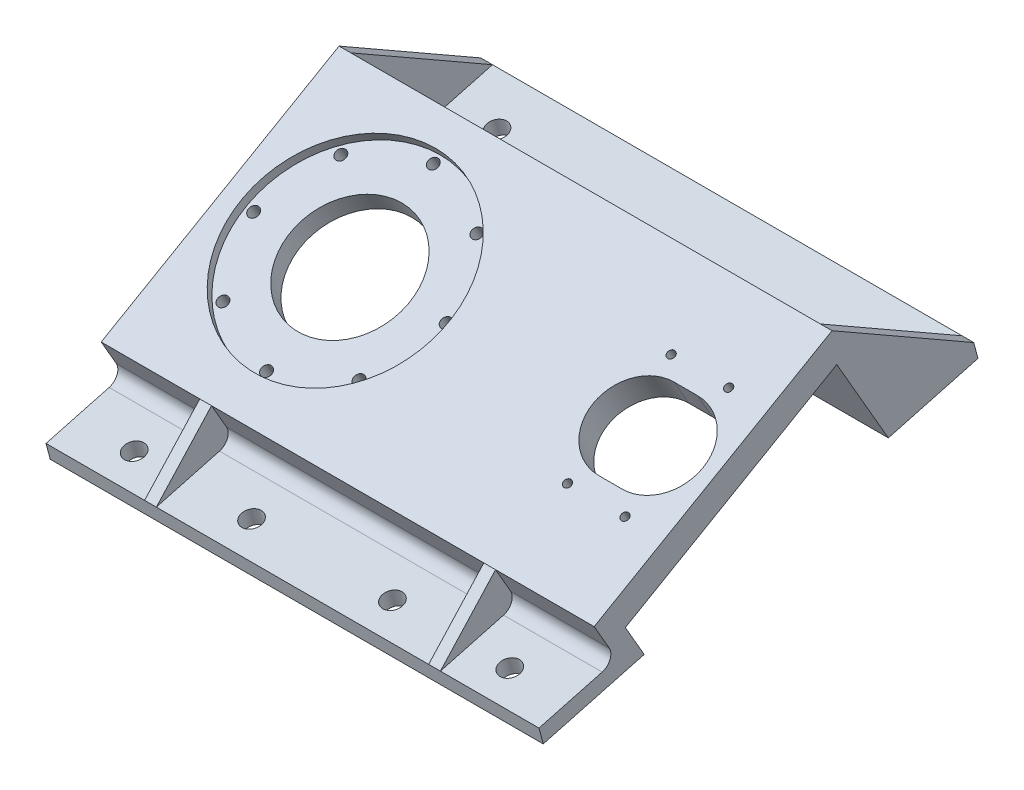
from build123d import *

# Parameters (mm, degrees)
EXTRUDE_1_DEPTH      = 30
SKETCH_2_R           = 44.45
CUT_EXTRUDE_1_DEPTH  = 4
SKETCH_3_R           = 25.5
SKETCH_3_R_2         = 2.25
CUT_EXTRUDE_2_DEPTH  = 188.619295383
CUT_EXTRUDE_3_DEPTH  = 189.215302247
SKETCH_5_R           = 1.65
CUT_EXTRUDE_4_DEPTH  = 189.215302247
EXTRUDE_START        = -30
EXTRUDE_2_DEPTH      = 30
CUT_EXTRUDE_5_DEPTH  = 198.040604952
CUT_EXTRUDE_7_DEPTH  = 233.432785983
CUT_EXTRUDE_8_DEPTH  = 233.432785983
CUT_EXTRUDE_9_DEPTH  = 233.432785983
FILLET_1_R           = 5
CUT_EXTRUDE_10_DEPTH = 233.432785983
EXTRUDE_START_2      = -5
EXTRUDE_3_DEPTH      = 5
EXTRUDE_4_DEPTH      = 5
SKETCH_14_R          = 4.25
CUT_EXTRUDE_11_DEPTH = 189.364728478
SKETCH_16_W          = 43
SKETCH_16_H          = 30
CUT_EXTRUDE_12_DEPTH = 233.432785983
EXTRUDE_7_REACH      = 188.592
SKETCH_18_W          = 210
SKETCH_18_H          = 5
EXTRUDE_8_DEPTH      = 210
EXTRUDE_9_DEPTH      = 5
EXTRUDE_10_DEPTH     = 5
SKETCH_22_R          = 4.25
CUT_EXTRUDE_13_DEPTH = 187.984035343
FILLET_2_R           = 5
EXTRUDE_11_DEPTH     = 2.5
CUT_EXTRUDE_START    = -5
CUT_EXTRUDE_16_DEPTH = 5
EXTRUDE_12_DEPTH     = 2.5
CUT_EXTRUDE_18_DEPTH = 5
CUT_EXTRUDE_19_DEPTH = 366.180703078


with BuildPart() as part:
    # 草图1 → 凸台-拉伸1 (new body)
    with BuildSketch(Plane(origin=(0, 0, 0), x_dir=(1, 0, 0), z_dir=(0, 1, 0))):
        with BuildLine():
            Line((170, 31.93), (170, -31.93))
            ThreePointArc((170, -31.93), (167.781993847, -38.210172909), (162.111885646, -41.704453387))
            Line((162.111885646, -41.704453387), (15.839142344, -73.308400404))
            ThreePointArc((15.839142344, -73.308400404), (-75, 0), (15.839142344, 73.308400404))
            Line((15.839142344, 73.308400404), (162.111885646, 41.704453387))
            ThreePointArc((162.111885646, 41.704453387), (167.781993847, 38.210172909), (170, 31.93))
        make_face()
    extrude(amount=EXTRUDE_1_DEPTH)

    # 草图2 → 切除-拉伸1 (cut)
    with BuildSketch(Plane(origin=(0, 30, 0), x_dir=(1, 0, 0), z_dir=(0, 1, 0))):
        with Locations(Location((0, 0, 0), (0, 0, 270))):
            Circle(SKETCH_2_R)
    extrude(amount=-CUT_EXTRUDE_1_DEPTH, mode=Mode.SUBTRACT)

    # 草图3 → 切除-拉伸2 (cut, through all)
    with BuildSketch(Plane(origin=(0, 26, 0), x_dir=(1, 0, 0), z_dir=(0, 1, 0))):
        with Locations(Location((0, 0, 0), (0, 0, 270))):
            Circle(SKETCH_3_R)
        with Locations(Location((0, 41, 0), (0, 0, 270))):
            Circle(SKETCH_3_R_2)
        with Locations(Location((28.991378029, 28.991378029, 0), (0, 0, 270))):
            Circle(SKETCH_3_R_2)
        with Locations(Location((41, 0, 0), (0, 0, 270))):
            Circle(SKETCH_3_R_2)
        with Locations(Location((28.991378029, -28.991378029, 0), (0, 0, 270))):
            Circle(SKETCH_3_R_2)
        with Locations(Location((0, -41, 0), (0, 0, 270))):
            Circle(SKETCH_3_R_2)
        with Locations(Location((-28.991378029, -28.991378029, 0), (0, 0, 270))):
            Circle(SKETCH_3_R_2)
        with Locations(Location((-41, 0, 0), (0, 0, 270))):
            Circle(SKETCH_3_R_2)
        with Locations(Location((-28.991378029, 28.991378029, 0), (0, 0, 270))):
            Circle(SKETCH_3_R_2)
    extrude(amount=-CUT_EXTRUDE_2_DEPTH, mode=Mode.SUBTRACT)

    # 草图4 → 切除-拉伸3 (cut, through all)
    with BuildSketch(Plane(origin=(0, 30, 0), x_dir=(1, 0, 0), z_dir=(0, 1, 0))):
        with BuildLine():
            Line((124, 18.5), (134, 18.5))
            ThreePointArc((134, 18.5), (152.5, 0), (134, -18.5))
            Line((134, -18.5), (124, -18.5))
            ThreePointArc((124, -18.5), (105.5, 0), (124, 18.5))
        make_face()
    extrude(amount=-CUT_EXTRUDE_3_DEPTH, mode=Mode.SUBTRACT)

    # 草图5 → 切除-拉伸4 (cut, through all)
    with BuildSketch(Plane(origin=(0, 30, 0), x_dir=(1, 0, 0), z_dir=(0, 1, 0))):
        with Locations(Location((116.75, 25.5, 0), (0, 0, 270))):
            Circle(SKETCH_5_R)
        with Locations(Location((141.25, 25.5, 0), (0, 0, 270))):
            Circle(SKETCH_5_R)
        with Locations(Location((141.25, -25.5, 0), (0, 0, 270))):
            Circle(SKETCH_5_R)
        with Locations(Location((116.75, -25.5, 0), (0, 0, 270))):
            Circle(SKETCH_5_R)
    extrude(amount=-CUT_EXTRUDE_4_DEPTH, mode=Mode.SUBTRACT)

    # 草图6 → 凸台-拉伸2 (add)
    with BuildSketch(Plane(origin=(0, 30, 0), x_dir=(1, 0, 0), z_dir=(0, 1, 0)).offset(EXTRUDE_START)):
        with BuildLine():
            Line((158, 95), (-52, 95))
            Line((-52, 95), (-52, 54.046276467))
            ThreePointArc((-52, 54.046276467), (-20.48558667, 72.148047366), (15.839142344, 73.308400404))
            Line((15.839142344, 73.308400404), (158, 42.592874655))
            Line((158, 42.592874655), (158, 95))
        make_face()
        with BuildLine():
            ThreePointArc((15.839142344, -73.308400404), (-20.48558667, -72.148047366), (-52, -54.046276467))
            Line((-52, -54.046276467), (-52, -95))
            Line((-52, -95), (158, -95))
            Line((158, -95), (158, -42.592874655))
            Line((158, -42.592874655), (15.839142344, -73.308400404))
        make_face()
    extrude(amount=EXTRUDE_2_DEPTH)

    # 草图7 → 切除-拉伸5 (cut, through all)
    with BuildSketch(Plane(origin=(0, 30, 0), x_dir=(1, 0, 0), z_dir=(0, 1, 0))):
        with BuildLine():
            Line((-52, 54.046276467), (-52, -54.046276467))
            ThreePointArc((-52, -54.046276467), (-75, 0), (-52, 54.046276467))
        make_face()
        with BuildLine():
            Line((158, 42.592874655), (158, -42.592874655))
            Line((158, -42.592874655), (162.111885646, -41.704453387))
            ThreePointArc((162.111885646, -41.704453387), (167.781993847, -38.210172909), (170, -31.93))
            Line((170, -31.93), (170, 31.93))
            ThreePointArc((170, 31.93), (167.781993847, 38.210172909), (162.111885646, 41.704453387))
            Line((162.111885646, 41.704453387), (158, 42.592874655))
        make_face()
    extrude(amount=-CUT_EXTRUDE_5_DEPTH, mode=Mode.SUBTRACT)

    # 草图9 → 切除-拉伸7 (cut, through all)
    with BuildSketch(Plane.ZY.offset(52)):
        Polygon((-95, 20), (-60, 10.621778265), (-60, 30), (-95, 30), align=None)
    extrude(amount=-CUT_EXTRUDE_7_DEPTH, mode=Mode.SUBTRACT)

    # 草图10 → 切除-拉伸8 (cut, through all)
    with BuildSketch(Plane.ZY.offset(52)):
        Polygon((-95, 12.753066737), (-52, 1.231251463), (-52, 0), (-95, 0), align=None)
    extrude(amount=-CUT_EXTRUDE_8_DEPTH, mode=Mode.SUBTRACT)

    # 草图8 → 切除-拉伸9 (cut, through all)
    with BuildSketch(Plane.ZY.offset(52)):
        Polygon((0, 0), (52, 0), (52, 17.3), (-52, 17.3), (-52, 0), align=None)
    extrude(amount=-CUT_EXTRUDE_9_DEPTH, mode=Mode.SUBTRACT)

    # 圆角1
    fillet_1_edges = [part.edges().sort_by_distance(p)[0] for p in [
        (53, 10.621778265, -60),
    ]]
    fillet(fillet_1_edges, radius=FILLET_1_R)

    # 草图11 → 切除-拉伸10 (cut, through all)
    with BuildSketch(Plane.ZY.offset(52)):
        Polygon((-95, 12.753066737), (-93.188266684, 19.514547521), (-95, 20), align=None)
    extrude(amount=-CUT_EXTRUDE_10_DEPTH, mode=Mode.SUBTRACT)

    # 草图12 → 凸台-拉伸3 (add)
    with BuildSketch(Plane.ZY.offset(52).offset(EXTRUDE_START_2)):
        with BuildLine():
            Line((-93.188266684, 19.514547521), (-60, 30))
            Line((-60, 30), (-60, 17.137905129))
            ThreePointArc((-60, 17.137905129), (-61.956192855, 13.171138428), (-66.294095226, 12.308275998))
            Line((-66.294095226, 12.308275998), (-93.188266684, 19.514547521))
        make_face()
    extrude(amount=EXTRUDE_3_DEPTH)

    # 草图13 → 凸台-拉伸4 (add)
    with BuildSketch(Plane(origin=(158, 0, 0), x_dir=(0, 0, -1), z_dir=(1, 0, 0))):
        with BuildLine():
            Line((66.294095226, 12.308275998), (93.188266684, 19.514547521))
            Line((93.188266684, 19.514547521), (60, 30))
            Line((60, 30), (60, 17.137905129))
            ThreePointArc((60, 17.137905129), (61.956192855, 13.171138428), (66.294095226, 12.308275998))
        make_face()
    extrude(amount=-EXTRUDE_4_DEPTH)

    # 草图14 → 切除-拉伸11 (cut, through all)
    with BuildSketch(Plane(origin=(0, -5.089745962, -1.36379332), x_dir=(1, 0, 0), z_dir=(0, 0.9659258262890681, 0.2588190451025214))):
        with Locations(Location((-27, 82.063690052, 0), (0, 0, 270))):
            Circle(SKETCH_14_R)
        with Locations(Location((23, 82.063690052, 0), (0, 0, 270))):
            Circle(SKETCH_14_R)
        with Locations(Location((83, 82.063690052, 0), (0, 0, 270))):
            Circle(SKETCH_14_R)
        with Locations(Location((133, 82.063690052, 0), (0, 0, 270))):
            Circle(SKETCH_14_R)
    extrude(amount=-CUT_EXTRUDE_11_DEPTH, mode=Mode.SUBTRACT)

    # 草图16 → 切除-拉伸12 (cut, through all)
    with BuildSketch(Plane.ZY.offset(52)):
        with Locations((73.5, 15)):
            Rectangle(SKETCH_16_W, SKETCH_16_H)
    extrude(amount=-CUT_EXTRUDE_12_DEPTH, mode=Mode.SUBTRACT)

    # 凸台-拉伸7: up to this plane
    extrude_7_end = Plane(origin=(0, -11.851226746, -3.175526636), z_dir=(0, -0.9659258262890681, -0.25881904510252146))
    # 草图18 → 凸台-拉伸7 (add, up to the surface)
    with BuildSketch(Plane(origin=(0, 30, 0), x_dir=(1, 0, 0), z_dir=(0, 1, 0)), mode=Mode.PRIVATE) as extrude_7_sk1:
        with Locations((53, -54.5)):
            Rectangle(SKETCH_18_W, SKETCH_18_H)
    extrude_7_tool1 = split(extrude(extrude_7_sk1.sketch, amount=-EXTRUDE_7_REACH, mode=Mode.PRIVATE), bisect_by=extrude_7_end, keep=Keep.BOTH, mode=Mode.PRIVATE)
    add(extrude_7_tool1.solids().sort_by_distance((53, 30, 54.5))[0])

    # 草图19 → 凸台-拉伸8 (add)
    with BuildSketch(Plane.ZY.offset(52)):
        Polygon((57, -27.975210512), (90.188266684, -36.867979769), (92, -30.106498985), (57, -20.72827725), align=None)
    extrude(amount=-EXTRUDE_8_DEPTH)

    # 草图20 → 凸台-拉伸9 (add)
    with BuildSketch(Plane.ZY.offset(52)):
        Polygon((92, -30.106498985), (57, -20.72827725), (57, 30), align=None)
    extrude(amount=-EXTRUDE_9_DEPTH)

    # 草图21 → 凸台-拉伸10 (add)
    with BuildSketch(Plane(origin=(158, 0, 0), x_dir=(0, 0, -1), z_dir=(1, 0, 0))):
        Polygon((-57, 30), (-92, -30.106498985), (-57, -20.72827725), align=None)
    extrude(amount=-EXTRUDE_10_DEPTH)

    # 草图22 → 切除-拉伸13 (cut, through all)
    with BuildSketch(Plane(origin=(0, -5.089745962, -1.36379332), x_dir=(1, 0, 0), z_dir=(0, 0.9659258262890686, 0.25881904510251946))):
        with Locations(Location((-27, -77.936309948, 0), (0, 0, 270))):
            Circle(SKETCH_22_R)
        with Locations(Location((23, -69.936309948, 0), (0, 0, 270))):
            Circle(SKETCH_22_R)
        with Locations(Location((83, -69.936309948, 0), (0, 0, 270))):
            Circle(SKETCH_22_R)
        with Locations(Location((133, -77.936309948, 0), (0, 0, 270))):
            Circle(SKETCH_22_R)
    extrude(amount=-CUT_EXTRUDE_13_DEPTH, mode=Mode.SUBTRACT)

    # 圆角2
    fillet_2_edges = [part.edges().sort_by_distance(p)[0] for p in [
        (53, -20.72827725, 57),
    ]]
    fillet(fillet_2_edges, radius=FILLET_2_R)

    # 草图27 → 凸台-拉伸11 (add, symmetric)
    with BuildSketch(Plane(origin=(113.5, 0, 0), x_dir=(0, 0, -1), z_dir=(1, 0, 0))):
        with BuildLine():
            Line((60, 30), (60, 17.137905129))
            ThreePointArc((60, 17.137905129), (61.956192855, 13.171138428), (66.294095226, 12.308275998))
            Line((66.294095226, 12.308275998), (93.188266684, 19.514547521))
            Line((93.188266684, 19.514547521), (60, 30))
        make_face()
    extrude(amount=EXTRUDE_11_DEPTH, both=True)

    # 草图29 → 切除-拉伸16 (cut)
    with BuildSketch(Plane.ZY.offset(-153).offset(CUT_EXTRUDE_START)):
        with BuildLine():
            Line((-60, 17.137905129), (-60, 30))
            Line((-60, 30), (-93.188266684, 19.514547521))
            Line((-93.188266684, 19.514547521), (-66.294095226, 12.308275998))
            ThreePointArc((-66.294095226, 12.308275998), (-61.956192855, 13.171138428), (-60, 17.137905129))
        make_face()
    extrude(amount=CUT_EXTRUDE_16_DEPTH, mode=Mode.SUBTRACT)

    # 草图30 → 凸台-拉伸12 (add, symmetric)
    with BuildSketch(Plane.ZY.offset(7.5)):
        with BuildLine():
            Line((-93.188266684, 19.514547521), (-66.294095226, 12.308275998))
            ThreePointArc((-66.294095226, 12.308275998), (-61.956192855, 13.171138428), (-60, 17.137905129))
            Line((-60, 17.137905129), (-60, 30))
            Line((-60, 30), (-93.188266684, 19.514547521))
        make_face()
    extrude(amount=EXTRUDE_12_DEPTH, both=True)

    # 草图31 → 切除-拉伸18 (cut)
    with BuildSketch(Plane(origin=(-47, 0, 0), x_dir=(0, 0, -1), z_dir=(1, 0, 0))):
        with BuildLine():
            Line((66.294095226, 12.308275998), (93.188266684, 19.514547521))
            Line((93.188266684, 19.514547521), (60, 30))
            Line((60, 30), (60, 17.137905129))
            ThreePointArc((60, 17.137905129), (61.956192855, 13.171138428), (66.294095226, 12.308275998))
        make_face()
    extrude(amount=-CUT_EXTRUDE_18_DEPTH, mode=Mode.SUBTRACT)

    # 镜向2: part across plane


with BuildPart() as part_1:
    add(part.part)
    add(part.part.mirror(Plane(origin=(158, 12.753066737, -95), x_dir=(1, 0, 0), z_dir=(0, -0.2588190451025203, 0.9659258262890684))))

    # 草图32 → 切除-拉伸19 (cut, through all)
    with BuildSketch(Plane.ZY.offset(52)):
        Polygon((-93.188266684, 19.514547521), (-80.506197372, 66.84467454), (104.682069312, 17.223628034), (90.188266684, -36.867979769), (-95, 12.753066737), align=None)
    extrude(amount=-CUT_EXTRUDE_19_DEPTH, mode=Mode.SUBTRACT)


solid = part_1.part
